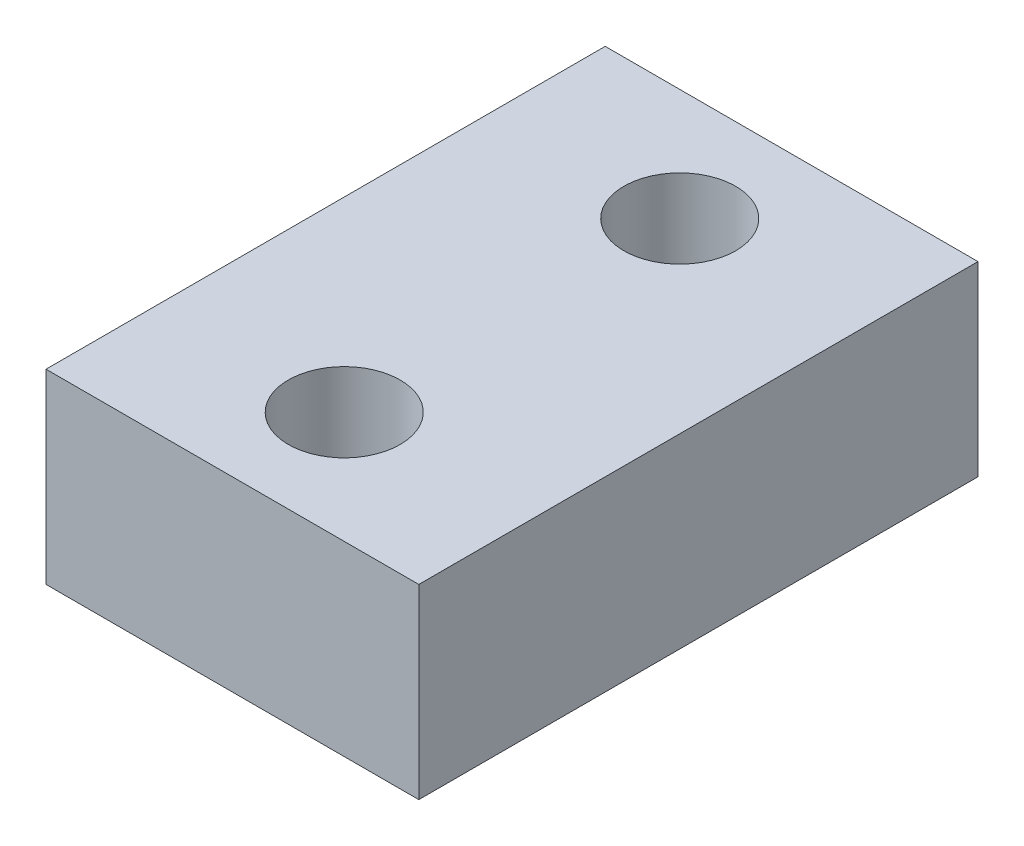
from build123d import *

# Parameters (mm, degrees)
SCHIZZO1_W                   = 10
SCHIZZO1_H                   = 5
ESTRUSIONE_ESTRUSIONE1_DEPTH = 15
SCHIZZO2_R                   = 1.5
TAGLIO_ESTRUSIONE1_DEPTH     = 19.708286934


with BuildPart() as part:
    # Schizzo1 → Estrusione-Estrusione1 (new body)
    with BuildSketch(Plane.XY):
        with Locations((-5, 2.5)):
            Rectangle(SCHIZZO1_W, SCHIZZO1_H)
    extrude(amount=ESTRUSIONE_ESTRUSIONE1_DEPTH)

    # Schizzo2 → Taglio-Estrusione1 (cut, through all)
    with BuildSketch(Plane(origin=(0, 0, 0), x_dir=(-1, 0, 0), z_dir=(0, -1, 0))):
        with Locations(Location((5, -12, 0), (0, 0, 180))):
            Circle(SCHIZZO2_R)
        with Locations(Location((5, -3, 0), (0, 0, 180))):
            Circle(SCHIZZO2_R)
    extrude(amount=-TAGLIO_ESTRUSIONE1_DEPTH, mode=Mode.SUBTRACT)


solid = part.part
